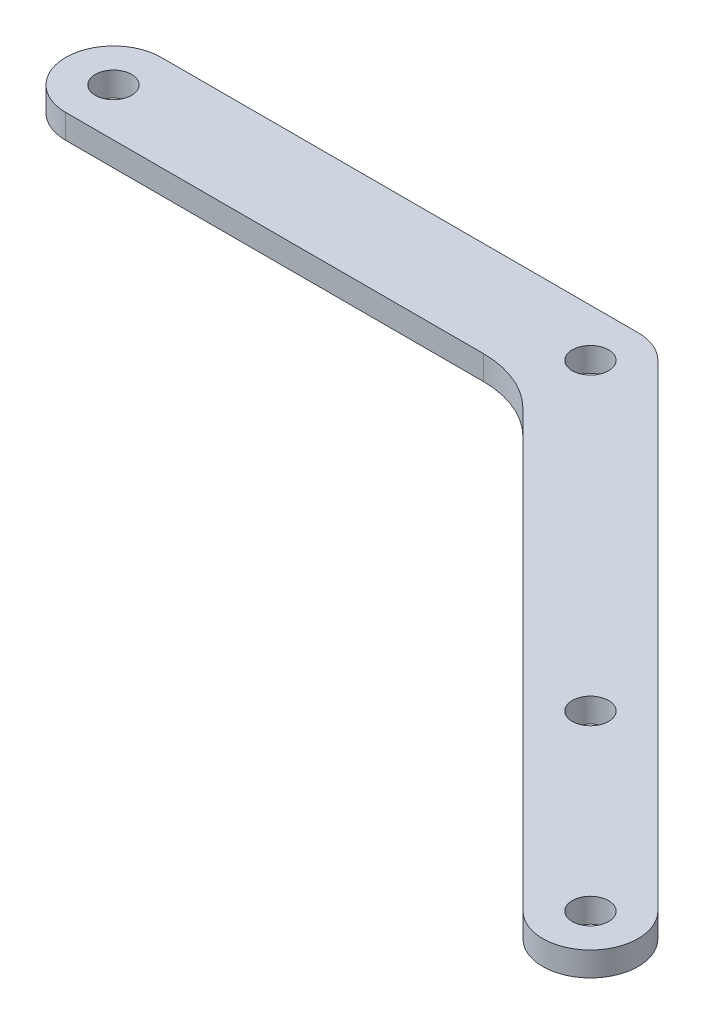
from build123d import *

# Parameters (mm, degrees)
SKETCH1_R           = 4.7625
BOSS_EXTRUDE1_DEPTH = 3.175
FILLET1_R           = 25


with BuildPart() as part:
    # Sketch1 → Boss-Extrude1 (new, symmetric)
    # profile 1 of 3: a face of its own
    with BuildSketch(Plane(origin=(0, 0, 0), x_dir=(1, 0, 0), z_dir=(0, 1, 0))):
        with BuildLine():
            Line((-125, -12.5), (-5.17766953, -12.5))
            Line((-5.17766953, -12.5), (-8.838834765, -8.838834765))
            ThreePointArc((-8.838834765, -8.838834765), (-11.548494156, 4.783542905), (0, 12.5))
            Line((0, 12.5), (-125, 12.5))
            ThreePointArc((-125, 12.5), (-137.5, 0), (-125, -12.5))
        make_face()
        with Locations(Location((-125, 0, 0), (0, 0, 270))):
            Circle(SKETCH1_R, mode=Mode.SUBTRACT)
    # profile 2 of 3: a face of its own
    with BuildSketch(Plane(origin=(0, 0, 0), x_dir=(1, 0, 0), z_dir=(0, 1, 0))):
        with BuildLine():
            Line((-5.17766953, -12.5), (0, -12.5))
            ThreePointArc((0, -12.5), (11.548494156, -4.783542905), (8.838834765, 8.838834765))
            ThreePointArc((8.838834765, 8.838834765), (4.783542905, 11.548494156), (0, 12.5))
            ThreePointArc((0, 12.5), (-11.548494156, 4.783542905), (-8.838834765, -8.838834765))
            Line((-8.838834765, -8.838834765), (-5.17766953, -12.5))
        make_face()
        with Locations(Location((0, 0, 0), (0, 0, 270))):
            Circle(SKETCH1_R, mode=Mode.SUBTRACT)
    # profile 3 of 3: a face of its own
    with BuildSketch(Plane(origin=(0, 0, 0), x_dir=(1, 0, 0), z_dir=(0, 1, 0))):
        with BuildLine():
            ThreePointArc((8.838834765, 8.838834765), (11.548494156, -4.783542905), (0, -12.5))
            Line((0, -12.5), (-5.17766953, -12.5))
            Line((-5.17766953, -12.5), (116.161165235, -133.838834765))
            ThreePointArc((116.161165235, -133.838834765), (133.838834765, -133.838834765), (133.838834765, -116.161165235))
            Line((133.838834765, -116.161165235), (8.838834765, 8.838834765))
        make_face()
        with Locations(Location((125, -125, 0), (0, 0, 270))):
            Circle(SKETCH1_R, mode=Mode.SUBTRACT)
        with Locations(Location((79.583029745, -79.583029745, 0), (0, 0, 270))):
            Circle(SKETCH1_R, mode=Mode.SUBTRACT)
    extrude(amount=BOSS_EXTRUDE1_DEPTH, both=True)

    # Fillet1
    fillet1_edges = [part.edges().sort_by_distance(p)[0] for p in [
        (-5.17766953, 0, 12.5),
    ]]
    fillet(fillet1_edges, radius=FILLET1_R)


solid = part.part
